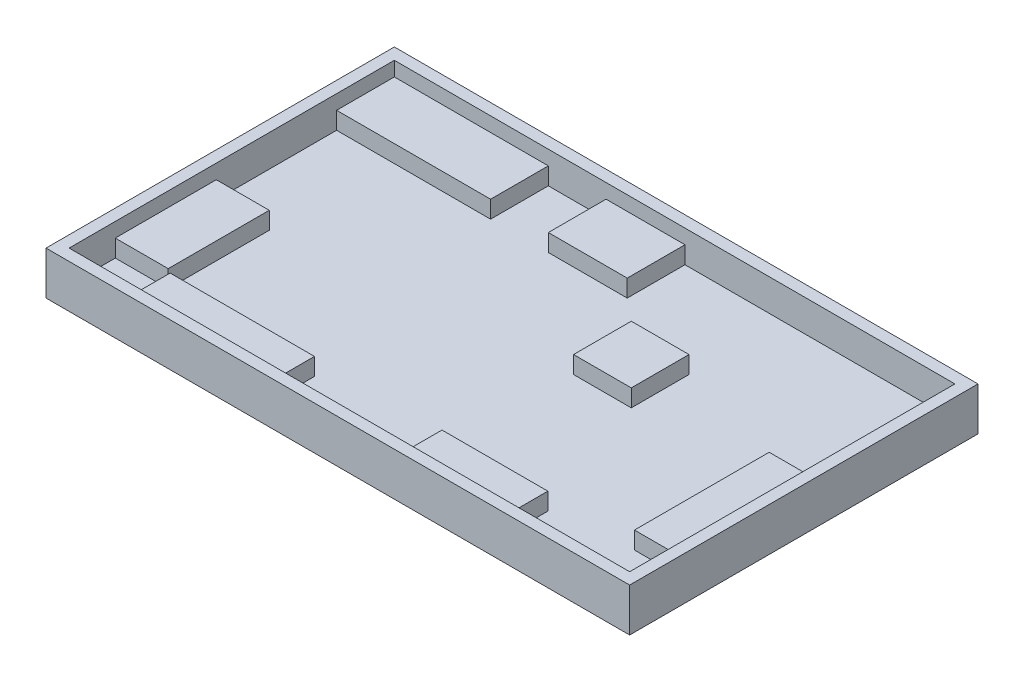
from build123d import *

# Parameters (mm, degrees)
SKETCH2_W           = 60.65
SKETCH2_H           = 36.2
BOSS_EXTRUDE1_DEPTH = 1.2
SKETCH3_W           = 60.65
SKETCH3_H           = 36.2
SKETCH3_W_2         = 58.25
SKETCH3_H_2         = 33.8
BOSS_EXTRUDE2_DEPTH = 3.3
SKETCH4_W           = 16
SKETCH4_H           = 6
SKETCH4_W_2         = 5.5
SKETCH4_H_2         = 10.5
SKETCH4_W_3         = 11
SKETCH4_H_3         = 4.5
SKETCH4_W_4         = 15
SKETCH4_W_5         = 5
SKETCH4_H_4         = 14
SKETCH4_W_6         = 8.2
SKETCH4_W_7         = 6
BOSS_EXTRUDE3_DEPTH = 1.8


with BuildPart() as part:
    # Sketch2 → Boss-Extrude1 (new body)
    with BuildSketch(Plane(origin=(0, 0, 0), x_dir=(1, 0, 0), z_dir=(0, 1, 0))):
        with Locations((29.125, 16.9)):
            Rectangle(SKETCH2_W, SKETCH2_H)
    extrude(amount=BOSS_EXTRUDE1_DEPTH)

    # Sketch3 → Boss-Extrude2 (add)
    with BuildSketch(Plane(origin=(0, 1.2, 0), x_dir=(1, 0, 0), z_dir=(0, 1, 0))):
        with Locations((29.125, 16.9)):
            Rectangle(SKETCH3_W, SKETCH3_H)
        with Locations((29.125, 16.9)):
            Rectangle(SKETCH3_W_2, SKETCH3_H_2, mode=Mode.SUBTRACT)
    extrude(amount=BOSS_EXTRUDE2_DEPTH)

    # Sketch4 → Boss-Extrude3 (add)
    with BuildSketch(Plane(origin=(0, 1.2, 0), x_dir=(1, 0, 0), z_dir=(0, 1, 0))):
        with Locations((8, 30.8)):
            Rectangle(SKETCH4_W, SKETCH4_H)
        with Locations((2.75, 10.05)):
            Rectangle(SKETCH4_W_2, SKETCH4_H_2)
        with Locations((39.75, 2.25)):
            Rectangle(SKETCH4_W_3, SKETCH4_H_3)
        with Locations((13.5, 2.25)):
            Rectangle(SKETCH4_W_4, SKETCH4_H_3)
        with Locations((55.75, 12.5)):
            Rectangle(SKETCH4_W_5, SKETCH4_H_4)
        with Locations((26.1, 30.8)):
            Rectangle(SKETCH4_W_6, SKETCH4_H)
        with Locations((37.29, 21.13)):
            Rectangle(SKETCH4_W_7, SKETCH4_H)
    extrude(amount=BOSS_EXTRUDE3_DEPTH)


solid = part.part
